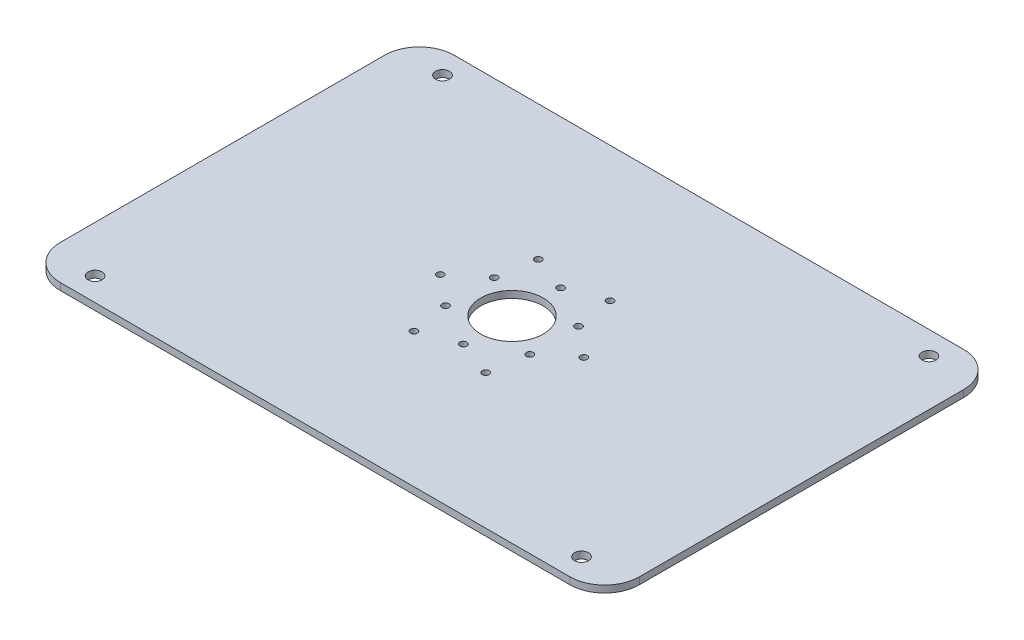
from build123d import *

# Parameters (mm, degrees)
SKETCH_1_W          = 250
SKETCH_1_H          = 170
SKETCH_1_R          = 3
EXTRUDE_1_DEPTH     = 3
FILLET_1_R          = 15
SKETCH_2_R          = 1.5
SKETCH_2_R_2        = 13.5
CUT_EXTRUDE_1_DEPTH = 152.191931002


with BuildPart() as part:
    # 草图1 → 凸台-拉伸1 (new body)
    with BuildSketch(Plane(origin=(0, 0, 0), x_dir=(1, 0, 0), z_dir=(0, 1, 0))):
        Rectangle(SKETCH_1_W, SKETCH_1_H)
        with Locations(Location((-105, 75, 0), (0, 0, 270))):
            Circle(SKETCH_1_R, mode=Mode.SUBTRACT)
        with Locations(Location((105, 75, 0), (0, 0, 270))):
            Circle(SKETCH_1_R, mode=Mode.SUBTRACT)
        with Locations(Location((-105, -75, 0), (0, 0, 270))):
            Circle(SKETCH_1_R, mode=Mode.SUBTRACT)
        with Locations(Location((105, -75, 0), (0, 0, 270))):
            Circle(SKETCH_1_R, mode=Mode.SUBTRACT)
    extrude(amount=EXTRUDE_1_DEPTH)

    # 圆角1
    fillet_1_edges = [part.edges().sort_by_distance(p)[0] for p in [
        (125, 1.5, 85),
        (-125, 1.5, 85),
        (-125, 1.5, -85),
        (125, 1.5, -85),
    ]]
    fillet(fillet_1_edges, radius=FILLET_1_R)

    # 草图2 → 切除-拉伸1 (cut, through all)
    with BuildSketch(Plane(origin=(0, 0, 0), x_dir=(1, 0, 0), z_dir=(0, 1, 0))):
        with Locations(Location((0, 21, 0), (0, 0, 270))):
            Circle(SKETCH_2_R)
        with Locations(Location((18.186533479, 10.5, 0), (0, 0, 270))):
            Circle(SKETCH_2_R)
        with Locations(Location((18.186533479, -10.5, 0), (0, 0, 270))):
            Circle(SKETCH_2_R)
        with Locations(Location((0, -21, 0), (0, 0, 270))):
            Circle(SKETCH_2_R)
        with Locations(Location((-18.186533479, -10.5, 0), (0, 0, 270))):
            Circle(SKETCH_2_R)
        with Locations(Location((-18.186533479, 10.5, 0), (0, 0, 270))):
            Circle(SKETCH_2_R)
        with Locations(Location((31, 0, 0), (0, 0, 270))):
            Circle(SKETCH_2_R)
        with Locations(Location((15.5, -26.846787517, 0), (0, 0, 270))):
            Circle(SKETCH_2_R)
        with Locations(Location((-15.5, -26.846787517, 0), (0, 0, 270))):
            Circle(SKETCH_2_R)
        with Locations(Location((-31, 0, 0), (0, 0, 270))):
            Circle(SKETCH_2_R)
        with Locations(Location((-15.5, 26.846787517, 0), (0, 0, 270))):
            Circle(SKETCH_2_R)
        with Locations(Location((15.5, 26.846787517, 0), (0, 0, 270))):
            Circle(SKETCH_2_R)
        with Locations(Location((0, 0, 0), (0, 0, 270))):
            Circle(SKETCH_2_R_2)
    extrude(amount=CUT_EXTRUDE_1_DEPTH, mode=Mode.SUBTRACT)


solid = part.part
